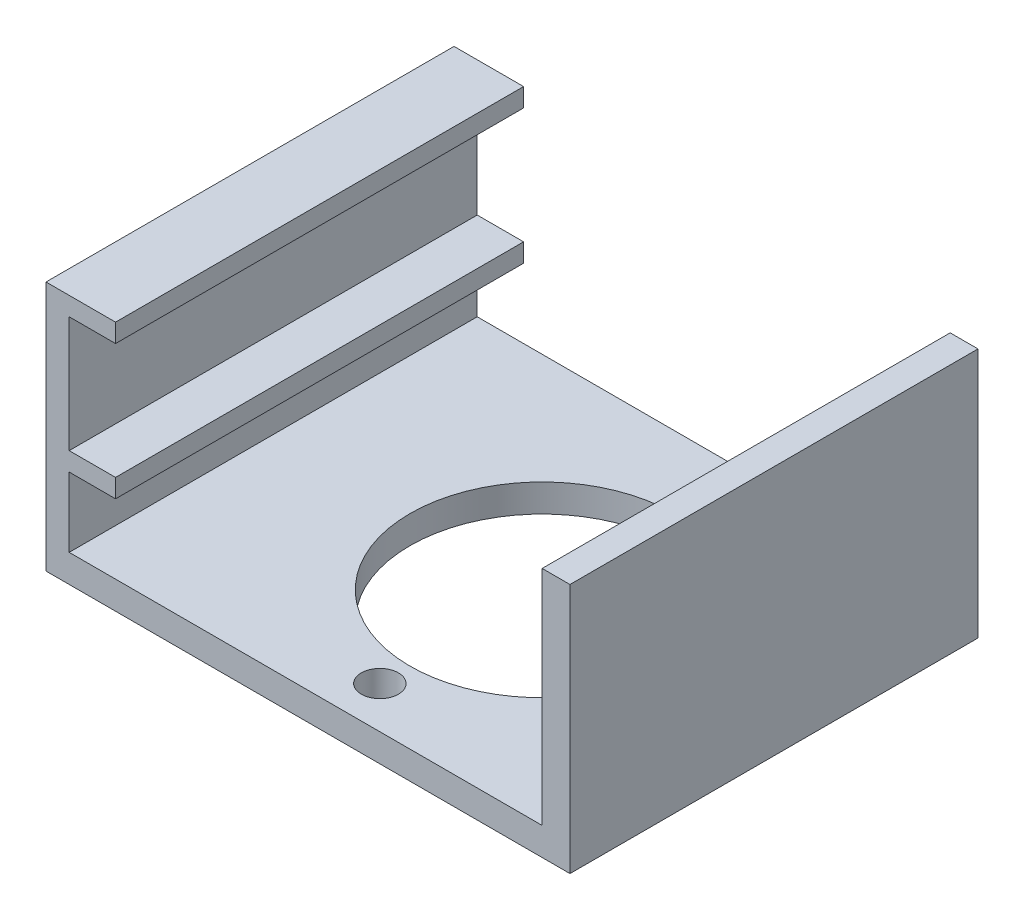
from build123d import *

# Parameters (mm, degrees)
SKETCH1_W            = 50
SKETCH1_H            = 40
BOSS_EXTRUDE1_DEPTH  = 3
SKETCH2_W            = 4
SKETCH2_H            = 40
BOSS_EXTRUDE2_DEPTH  = 24
SKETCH3_W            = 40
SKETCH3_H            = 13
CUT_EXTRUDE1_DEPTH   = 2
SKETCH5_W            = 2
SKETCH5_H            = 40
BOSS_EXTRUDE3_DEPTH  = 24
SKETCH6_R            = 2
CUT_EXTRUDE9_DEPTH   = 5
BOSS_EXTRUDE5_DEPTH  = 2
BOSS_EXTRUDE6_DEPTH  = 2
SKETCH12_W           = 44
SKETCH12_H           = 27
BOSS_EXTRUDE7_DEPTH  = 1
SKETCH14_W           = 44
SKETCH14_H           = 2
BOSS_EXTRUDE8_DEPTH  = 3
BOSS_EXTRUDE9_DEPTH  = 0.5
SKETCH15_W           = 44
SKETCH15_H           = 2
BOSS_EXTRUDE10_DEPTH = 3
SKETCH16_W           = 14.8
SKETCH16_H           = 3
CUT_EXTRUDE10_DEPTH  = 0.5
SKETCH17_W           = 44
SKETCH17_H           = 27
BOSS_EXTRUDE11_DEPTH = 4
SKETCH18_W           = 44
SKETCH18_H           = 24
CUT_EXTRUDE11_DEPTH  = 4
SKETCH21_R           = 14.25
CUT_EXTRUDE15_DEPTH  = 4
CUT_EXTRUDE16_START  = -4
CUT_EXTRUDE16_DEPTH  = 4
SKETCH24_W           = 44
SKETCH24_H           = 27
BOSS_EXTRUDE13_DEPTH = 1
SKETCH25_W           = 44
SKETCH25_H           = 12.5
CUT_EXTRUDE17_DEPTH  = 1
SKETCH26_W           = 44
SKETCH26_H           = 2
CUT_EXTRUDE18_DEPTH  = 1
SKETCH27_W           = 44
SKETCH27_H           = 2
CUT_EXTRUDE19_DEPTH  = 1
SKETCH28_W           = 44
SKETCH28_H           = 7.5
CUT_EXTRUDE20_DEPTH  = 3
SKETCH29_W           = 44
SKETCH29_H           = 27
BOSS_EXTRUDE14_DEPTH = 0.5


with BuildPart() as part:
    # Sketch1 → Boss-Extrude1 (new body)
    with BuildSketch(Plane(origin=(0, 0, 0), x_dir=(1, 0, 0), z_dir=(0, 1, 0))):
        with Locations((1.920937393, -5.615172506)):
            Rectangle(SKETCH1_W, SKETCH1_H)
    extrude(amount=BOSS_EXTRUDE1_DEPTH)

    # Sketch2 → Boss-Extrude2 (add)
    with BuildSketch(Plane(origin=(0, 3, 0), x_dir=(1, 0, 0), z_dir=(0, 1, 0))):
        with Locations((-21.079062607, -5.615172506)):
            Rectangle(SKETCH2_W, SKETCH2_H)
    extrude(amount=BOSS_EXTRUDE2_DEPTH)

    # Sketch3 → Cut-Extrude1 (cut)
    with BuildSketch(Plane(origin=(-19.079062607, 0, 0), x_dir=(0, 0, -1), z_dir=(1, 0, 0))):
        with Locations((-5.615172506, 18.5)):
            Rectangle(SKETCH3_W, SKETCH3_H)
    extrude(amount=-CUT_EXTRUDE1_DEPTH, mode=Mode.SUBTRACT)

    # Sketch5 → Boss-Extrude3 (add)
    with BuildSketch(Plane(origin=(0, 3, 0), x_dir=(1, 0, 0), z_dir=(0, 1, 0))):
        with Locations((25.920937393, -5.615172506)):
            Rectangle(SKETCH5_W, SKETCH5_H)
    extrude(amount=BOSS_EXTRUDE3_DEPTH)

    # Sketch6 → Cut-Extrude9 (cut)
    with BuildSketch(Plane.XZ):
        with Locations(Location((6.920937393, 23.115172506, 0), (0, 0, 270))):
            Circle(SKETCH6_R)
        with Locations(Location((6.920937393, -11.884827494, 0), (0, 0, 270))):
            Circle(SKETCH6_R)
        with BuildLine():
            Line((24.420937393, 13.015172506), (18.923020545, 13.015172506))
            ThreePointArc((18.923020545, 13.015172506), (-7.179062607, 5.615172506), (18.923020545, -1.784827494))
            Line((18.923020545, -1.784827494), (24.420937393, -1.784827494))
            Line((24.420937393, -1.784827494), (24.420937393, 5.615172506))
            Line((24.420937393, 5.615172506), (24.420937393, 13.015172506))
        make_face()
    extrude(amount=-CUT_EXTRUDE9_DEPTH, mode=Mode.SUBTRACT)

    # Sketch10 → Boss-Extrude5 (add)
    with BuildSketch(Plane.XY.offset(25.615172506)):
        Polygon((-19.079062607, 27), (-19.079062607, 25), (-21.079062607, 25), (-21.079062607, 12), (-19.079062607, 12), (-19.079062607, 3), (24.920937393, 3), (24.920937393, 27), (26.920937393, 27), (26.920937393, 0), (-23.079062607, 0), (-23.079062607, 27), align=None)
    extrude(amount=BOSS_EXTRUDE5_DEPTH)

    # Sketch11 → Boss-Extrude6 (add)
    with BuildSketch(Plane(origin=(0, 0, -14.384827494), x_dir=(-1, 0, 0), z_dir=(0, 0, -1))):
        Polygon((-26.920937393, 27), (-24.920937393, 27), (-24.920937393, 3), (19.079062607, 3), (19.079062607, 12), (21.079062607, 12), (21.079062607, 25), (19.079062607, 25), (19.079062607, 27), (23.079062607, 27), (23.079062607, 0), (-26.920937393, 0), align=None)
    extrude(amount=BOSS_EXTRUDE6_DEPTH)

    # Sketch12 → Boss-Extrude7 (add)
    with BuildSketch(Plane(origin=(26.920937393, 0, 0), x_dir=(0, 0, -1), z_dir=(1, 0, 0))):
        with Locations((-5.615172506, 13.5)):
            Rectangle(SKETCH12_W, SKETCH12_H)
    extrude(amount=BOSS_EXTRUDE7_DEPTH)

    # Sketch14 → Boss-Extrude8 (add)
    with BuildSketch(Plane(origin=(-19.079062607, 0, 0), x_dir=(0, 0, -1), z_dir=(1, 0, 0))):
        with Locations((-5.615172506, 26)):
            Rectangle(SKETCH14_W, SKETCH14_H)
    extrude(amount=BOSS_EXTRUDE8_DEPTH)

    # 3DSketch1 → Boss-Extrude9 (add)
    with BuildSketch(Plane(origin=(-21.079062607, 12, 27.615172506), x_dir=(0.04540766091864994, 0, -0.9989685402102996), z_dir=(0, -1, 0))):
        Polygon((0, 0), (0.090815322, 1.99793708), (44.045431091, 0), (43.954615769, -1.99793708), align=None)
    extrude(amount=-BOSS_EXTRUDE9_DEPTH)

    # Sketch15 → Boss-Extrude10 (add)
    with BuildSketch(Plane(origin=(-19.079062607, 0, 0), x_dir=(0, 0, -1), z_dir=(1, 0, 0))):
        with Locations((-5.615172506, 11.5)):
            Rectangle(SKETCH15_W, SKETCH15_H)
    extrude(amount=BOSS_EXTRUDE10_DEPTH)

    # Sketch16 → Cut-Extrude10 (cut)
    with BuildSketch(Plane.ZY.offset(-24.420937393)):
        with Locations((5.615172506, 1.5)):
            Rectangle(SKETCH16_W, SKETCH16_H)
    extrude(amount=-CUT_EXTRUDE10_DEPTH, mode=Mode.SUBTRACT)

    # Sketch17 → Boss-Extrude11 (add)
    with BuildSketch(Plane(origin=(27.920937393, 0, 0), x_dir=(0, 0, -1), z_dir=(1, 0, 0))):
        with Locations((-5.615172506, 13.5)):
            Rectangle(SKETCH17_W, SKETCH17_H)
    extrude(amount=BOSS_EXTRUDE11_DEPTH)

    # Sketch18 → Cut-Extrude11 (cut)
    with BuildSketch(Plane.ZY.offset(-24.920937393)):
        with Locations((5.615172506, 15)):
            Rectangle(SKETCH18_W, SKETCH18_H)
    extrude(amount=-CUT_EXTRUDE11_DEPTH, mode=Mode.SUBTRACT)

    # Sketch21 → Cut-Extrude15 (cut)
    with BuildSketch(Plane(origin=(0, 0, 0), x_dir=(-1, 0, 0), z_dir=(0, -1, 0))):
        with Locations((-6.920937393, -5.615172506)):
            Circle(SKETCH21_R)
    extrude(amount=-CUT_EXTRUDE15_DEPTH, mode=Mode.SUBTRACT)

    # Sketch22 → Cut-Extrude16 (cut)
    with BuildSketch(Plane(origin=(0, 3, 0), x_dir=(1, 0, 0), z_dir=(0, 1, 0)).offset(CUT_EXTRUDE16_START)):
        with BuildLine():
            ThreePointArc((21.106680727, 1.784827494), (20.39103932, 3.019158274), (19.568281538, 4.184827494))
            Line((19.568281538, 4.184827494), (17.266105347, 4.184827494))
            ThreePointArc((17.266105347, 4.184827494), (18.246250908, 3.03351374), (19.09888878, 1.784827494))
            Line((19.09888878, 1.784827494), (21.106680727, 1.784827494))
        make_face()
        with BuildLine():
            Line((17.266105347, -15.415172506), (19.568281538, -15.415172506))
            ThreePointArc((19.568281538, -15.415172506), (20.39103932, -14.249503286), (21.106680727, -13.015172506))
            Line((21.106680727, -13.015172506), (19.09888878, -13.015172506))
            ThreePointArc((19.09888878, -13.015172506), (18.246250908, -14.263858752), (17.266105347, -15.415172506))
        make_face()
    extrude(amount=CUT_EXTRUDE16_DEPTH, mode=Mode.SUBTRACT)

    # Sketch24 → Boss-Extrude13 (add)
    with BuildSketch(Plane.ZY.offset(23.079062607)):
        with Locations((5.615172506, 13.5)):
            Rectangle(SKETCH24_W, SKETCH24_H)
    extrude(amount=BOSS_EXTRUDE13_DEPTH)

    # Sketch25 → Cut-Extrude17 (cut)
    with BuildSketch(Plane(origin=(-21.079062607, 0, 0), x_dir=(0, 0, -1), z_dir=(1, 0, 0))):
        with Locations((-5.615172506, 18.75)):
            Rectangle(SKETCH25_W, SKETCH25_H)
    extrude(amount=-CUT_EXTRUDE17_DEPTH, mode=Mode.SUBTRACT)

    # Sketch26 → Cut-Extrude18 (cut)
    with BuildSketch(Plane(origin=(-16.079062607, 0, 0), x_dir=(0, 0, -1), z_dir=(1, 0, 0))):
        with Locations((-5.615172506, 26)):
            Rectangle(SKETCH26_W, SKETCH26_H)
    extrude(amount=-CUT_EXTRUDE18_DEPTH, mode=Mode.SUBTRACT)

    # Sketch27 → Cut-Extrude19 (cut)
    with BuildSketch(Plane(origin=(-16.079062607, 0, 0), x_dir=(0, 0, -1), z_dir=(1, 0, 0))):
        with Locations((-5.615172506, 11.5)):
            Rectangle(SKETCH27_W, SKETCH27_H)
    extrude(amount=-CUT_EXTRUDE19_DEPTH, mode=Mode.SUBTRACT)

    # Sketch28 → Cut-Extrude20 (cut)
    with BuildSketch(Plane(origin=(-19.079062607, 0, 0), x_dir=(0, 0, -1), z_dir=(1, 0, 0))):
        with Locations((-5.615172506, 6.75)):
            Rectangle(SKETCH28_W, SKETCH28_H)
    extrude(amount=-CUT_EXTRUDE20_DEPTH, mode=Mode.SUBTRACT)

    # Sketch29 → Boss-Extrude14 (add)
    with BuildSketch(Plane.ZY.offset(24.079062607)):
        with Locations((5.615172506, 13.5)):
            Rectangle(SKETCH29_W, SKETCH29_H)
    extrude(amount=BOSS_EXTRUDE14_DEPTH)


solid = part.part
